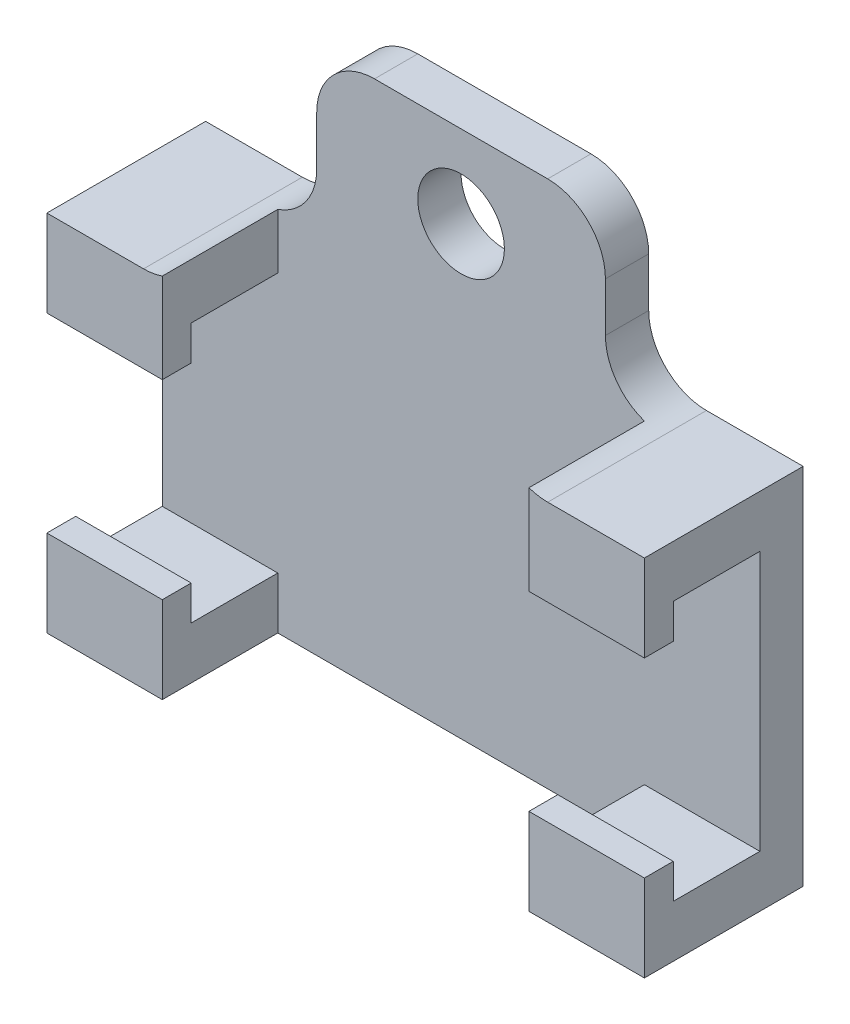
from build123d import *

# Parameters (mm, degrees)
SKETCH1_W             = 20.7
SKETCH1_H             = 24
BOSS_EXTRUDE1_DEPTH   = 1.5
SKETCH2_W             = 20.7
SKETCH2_H             = 3
BOSS_EXTRUDE2_DEPTH   = 4
SKETCH3_W             = 20.7
SKETCH3_H             = 3
CUT_EXTRUDE1_DEPTH    = 1.2
SKETCH4_W             = 20.7
SKETCH4_H             = 3
CUT_EXTRUDE2_DEPTH    = 1.2
SKETCH5_R             = 1.5
CUT_EXTRUDE3_DEPTH    = 32.945109172
SKETCH7_W             = 20.7
SKETCH7_H             = 5.7
CUT_EXTRUDE4_DEPTH    = 33.167374776
SKETCH8_W             = 12.7
SKETCH8_H             = 4
CUT_EXTRUDE5_DEPTH    = 29.171439438
SKETCH9_W             = 5.35
SKETCH9_H             = 5.7
CUT_EXTRUDE6_DEPTH    = 32.945109172
FILLET1_R             = 2
BODY_MOVE_COPY1_ANGLE = 90


with BuildPart() as part:
    # Sketch1 → Boss-Extrude1 (new body)
    with BuildSketch(Plane(origin=(0, 0, 0), x_dir=(1, 0, 0), z_dir=(0, 1, 0))):
        with Locations((10.35, 12)):
            Rectangle(SKETCH1_W, SKETCH1_H)
    extrude(amount=BOSS_EXTRUDE1_DEPTH)

    # Sketch2 → Boss-Extrude2 (add)
    with BuildSketch(Plane(origin=(0, 1.5, 0), x_dir=(1, 0, 0), z_dir=(0, 1, 0))):
        with Locations((10.35, 16.8)):
            Rectangle(SKETCH2_W, SKETCH2_H)
        with Locations((10.35, 7.2)):
            Rectangle(SKETCH2_W, SKETCH2_H)
    extrude(amount=BOSS_EXTRUDE2_DEPTH)

    # Sketch3 → Cut-Extrude1 (cut)
    with BuildSketch(Plane.XY.offset(-15.3)):
        with Locations((10.35, 3)):
            Rectangle(SKETCH3_W, SKETCH3_H)
    extrude(amount=-CUT_EXTRUDE1_DEPTH, mode=Mode.SUBTRACT)

    # Sketch4 → Cut-Extrude2 (cut)
    with BuildSketch(Plane(origin=(0, 0, -8.7), x_dir=(-1, 0, 0), z_dir=(0, 0, -1))):
        with Locations((-10.35, 3)):
            Rectangle(SKETCH4_W, SKETCH4_H)
    extrude(amount=-CUT_EXTRUDE2_DEPTH, mode=Mode.SUBTRACT)

    # Sketch5 → Cut-Extrude3 (cut, through all)
    with BuildSketch(Plane(origin=(0, 1.5, 0), x_dir=(1, 0, 0), z_dir=(0, 1, 0))):
        with Locations(Location((10.35, 21.15, 0), (0, 0, 270))):
            Circle(SKETCH5_R)
        with Locations(Location((10.35, 2.85, 0), (0, 0, 270))):
            Circle(SKETCH5_R)
    extrude(amount=-CUT_EXTRUDE3_DEPTH, mode=Mode.SUBTRACT)

    # Sketch7 → Cut-Extrude4 (cut, through all)
    with BuildSketch(Plane(origin=(0, 0, 0), x_dir=(1, 0, 0), z_dir=(0, 1, 0))):
        with Locations((10.35, 2.85)):
            Rectangle(SKETCH7_W, SKETCH7_H)
    extrude(amount=CUT_EXTRUDE4_DEPTH, mode=Mode.SUBTRACT)

    # Sketch8 → Cut-Extrude5 (cut, through all)
    with BuildSketch(Plane.XY.offset(-5.7)):
        with Locations((10.35, 3.5)):
            Rectangle(SKETCH8_W, SKETCH8_H)
    extrude(amount=-CUT_EXTRUDE5_DEPTH, mode=Mode.SUBTRACT)

    # Sketch9 → Cut-Extrude6 (cut, through all)
    with BuildSketch(Plane(origin=(0, 1.5, 0), x_dir=(1, 0, 0), z_dir=(0, 1, 0))):
        with Locations((2.675, 21.15)):
            Rectangle(SKETCH9_W, SKETCH9_H)
        with Locations((18.025, 21.15)):
            Rectangle(SKETCH9_W, SKETCH9_H)
    extrude(amount=-CUT_EXTRUDE6_DEPTH, mode=Mode.SUBTRACT)

    # Fillet1
    fillet1_edges = [part.edges().sort_by_distance(p)[0] for p in [
        (5.35, 0.75, -18.3),
        (5.35, 0.75, -24),
        (15.35, 0.75, -24),
        (15.35, 0.75, -18.3),
    ]]
    fillet(fillet1_edges, radius=FILLET1_R)


with BuildPart() as part_1:
    # Body-Move/Copy1: moved
    add(part.part.rotate(Axis((0, 2.75, -20.7), (1, 0, 0)), BODY_MOVE_COPY1_ANGLE))


solid = part_1.part
